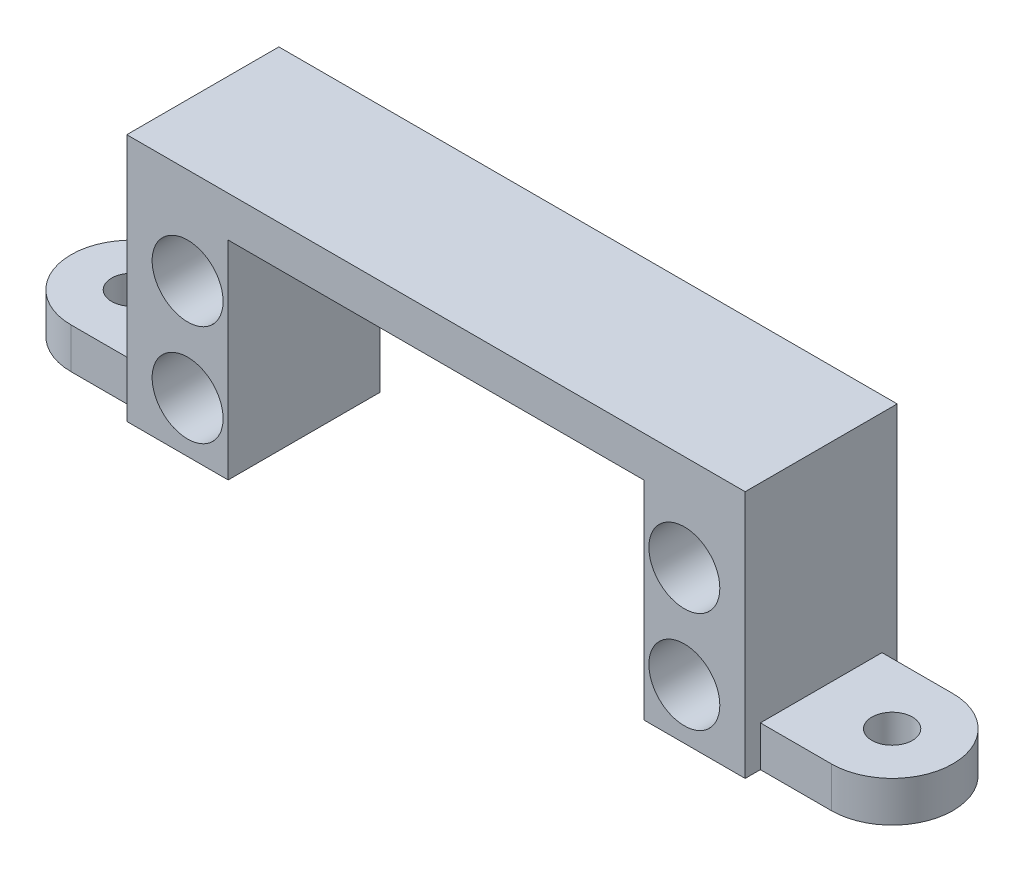
from build123d import *

# Parameters (mm, degrees)
BOSS_EXTRUDE1_DEPTH = 15
SKETCH2_R           = 3.5
CUT_EXTRUDE1_DEPTH  = 11
CUT_EXTRUDE2_REACH  = 59.639
SKETCH3_R           = 2
SKETCH4_R           = 2
BOSS_EXTRUDE5_DEPTH = 4


with BuildPart() as part:
    # Sketch1 → Boss-Extrude1 (new body)
    with BuildSketch(Plane.XY):
        Polygon((0, 0), (0, 20.5), (41, 20.5), (41, 0), (51, 0), (51, 24.5), (-10, 24.5), (-10, 0), align=None)
    extrude(amount=BOSS_EXTRUDE1_DEPTH)

    # Sketch2 → Cut-Extrude1 (cut)
    with BuildSketch(Plane.XY.offset(15)):
        with Locations((45, 5)):
            Circle(SKETCH2_R)
        with Locations((45, 15)):
            Circle(SKETCH2_R)
        with Locations((-4, 5)):
            Circle(SKETCH2_R)
        with Locations((-4, 15)):
            Circle(SKETCH2_R)
    extrude(amount=-CUT_EXTRUDE1_DEPTH, mode=Mode.SUBTRACT)

    # Sketch3 → Cut-Extrude2 (cut, up to next)
    with BuildSketch(Plane.XY.offset(4), mode=Mode.PRIVATE) as cut_extrude2_sk1:
        with Locations((-4, 15)):
            Circle(SKETCH3_R)
    cut_extrude2_tool1 = extrude(cut_extrude2_sk1.sketch, amount=-CUT_EXTRUDE2_REACH, mode=Mode.PRIVATE) & part.part
    # Sketch3 → Cut-Extrude2 (cut, up to next)
    with BuildSketch(Plane.XY.offset(4), mode=Mode.PRIVATE) as cut_extrude2_sk2:
        with Locations((-4, 5)):
            Circle(SKETCH3_R)
    cut_extrude2_tool2 = extrude(cut_extrude2_sk2.sketch, amount=-CUT_EXTRUDE2_REACH, mode=Mode.PRIVATE) & part.part
    # Sketch3 → Cut-Extrude2 (cut, up to next)
    with BuildSketch(Plane.XY.offset(4), mode=Mode.PRIVATE) as cut_extrude2_sk3:
        with Locations((45, 15)):
            Circle(SKETCH3_R)
    cut_extrude2_tool3 = extrude(cut_extrude2_sk3.sketch, amount=-CUT_EXTRUDE2_REACH, mode=Mode.PRIVATE) & part.part
    # Sketch3 → Cut-Extrude2 (cut, up to next)
    with BuildSketch(Plane.XY.offset(4), mode=Mode.PRIVATE) as cut_extrude2_sk4:
        with Locations((45, 5)):
            Circle(SKETCH3_R)
    cut_extrude2_tool4 = extrude(cut_extrude2_sk4.sketch, amount=-CUT_EXTRUDE2_REACH, mode=Mode.PRIVATE) & part.part
    add(cut_extrude2_tool1.solids().sort_by_distance((-4, 15, 4))[0], mode=Mode.SUBTRACT)
    add(cut_extrude2_tool2.solids().sort_by_distance((-4, 5, 4))[0], mode=Mode.SUBTRACT)
    add(cut_extrude2_tool3.solids().sort_by_distance((45, 15, 4))[0], mode=Mode.SUBTRACT)
    add(cut_extrude2_tool4.solids().sort_by_distance((45, 5, 4))[0], mode=Mode.SUBTRACT)

    # Sketch4 → Boss-Extrude5 (add)
    # profile 1 of 2: a face of its own
    with BuildSketch(Plane.XZ):
        with BuildLine():
            Line((51, 1.5), (58, 1.5))
            ThreePointArc((58, 1.5), (64, 7.5), (58, 13.5))
            Line((58, 13.5), (51, 13.5))
            Line((51, 13.5), (51, 1.5))
        make_face()
        with Locations(Location((58, 7.5, 0), (0, 0, 270))):
            Circle(SKETCH4_R, mode=Mode.SUBTRACT)
    # profile 2 of 2: a face of its own
    with BuildSketch(Plane.XZ):
        with BuildLine():
            ThreePointArc((-17, 13.5), (-23, 7.5), (-17, 1.5))
            Line((-17, 1.5), (-10, 1.5))
            Line((-10, 1.5), (-10, 13.5))
            Line((-10, 13.5), (-17, 13.5))
        make_face()
        with Locations(Location((-17, 7.5, 0), (0, 0, 270))):
            Circle(SKETCH4_R, mode=Mode.SUBTRACT)
    extrude(amount=-BOSS_EXTRUDE5_DEPTH)


solid = part.part
